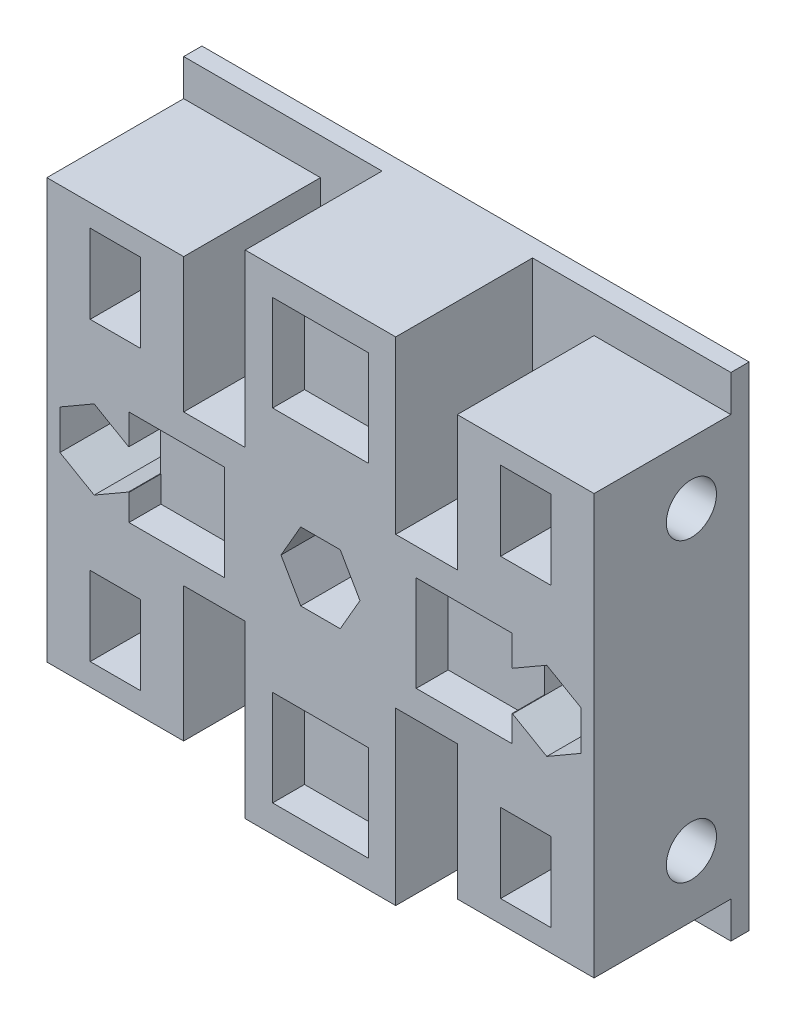
from build123d import *

# Parameters (mm, degrees)
ESQUISSE1_W               = 60
ESQUISSE1_H               = 54
ESQUISSE1_R               = 2
BOSS_EXTRU_1_DEPTH        = 2
ESQUISSE2_W               = 15
ESQUISSE2_H               = 13.5
BOSS_EXTRU_2_DEPTH        = 15
ENL_V_MAT_EXTRU_2_DEPTH   = 16
ESQUISSE5_W               = 4.75
ESQUISSE5_H               = 13.5
BOSS_EXTRU_3_DEPTH        = 17
ESQUISSE6_W               = 5.5
ESQUISSE6_H               = 8.66
ENL_V_MAT_EXTRU_3_DEPTH   = 11.25
ESQUISSE7_R               = 2.75
ENL_V_MAT_EXTRU_4_DEPTH   = 28
SYM_TRIE2_COPY_1_SKETCH_W = 15
SYM_TRIE2_COPY_1_SKETCH_H = 13.5
SYM_TRIE2_COPY_1_DEPTH    = 15
SYM_TRIE2_COPY_2_DEPTH    = 16
SYM_TRIE2_COPY_3_SKETCH_W = 4.75
SYM_TRIE2_COPY_3_SKETCH_H = 13.5
SYM_TRIE2_COPY_3_DEPTH    = 17
SYM_TRIE2_COPY_4_SKETCH_W = 5.5
SYM_TRIE2_COPY_4_SKETCH_H = 8.66
SYM_TRIE2_COPY_4_DEPTH    = 11.25
SYM_TRIE2_COPY_5_SKETCH_R = 2.75
SYM_TRIE2_COPY_5_DEPTH    = 28
ESQUISSE8_W               = 10.5
ESQUISSE8_H               = 3
BOSS_EXTRU_4_DEPTH        = 15
ESQUISSE12_W              = 15
ESQUISSE12_H              = 19
BOSS_EXTRU_6_DEPTH        = 15
ESQUISSE9_W               = 16.5
ESQUISSE9_H               = 16.5
ESQUISSE9_W_2             = 10.5
ESQUISSE9_H_2             = 10.5
BOSS_EXTRU_7_DEPTH        = 15
ENL_V_MAT_EXTRU_6_DEPTH   = 21
ESQUISSE13_W              = 10.5
ESQUISSE13_H              = 10.5
ENL_V_MAT_EXTRU_7_DEPTH   = 21
ESQUISSE15_R              = 2
ESQUISSE15_W              = 0.75
ESQUISSE15_H              = 2.25
BOSS_EXTRU_9_DEPTH        = 15
ENL_V_MAT_EXTRU_8_DEPTH   = 10
ESQUISSE17_W              = 10.5
ESQUISSE17_H              = 10.5
BOSS_EXTRU_10_DEPTH       = 11.5
ESQUISSE18_W              = 3.5
ESQUISSE18_H              = 4.330127019
ENL_V_MAT_EXTRU_9_DEPTH   = 1.5


with BuildPart() as part:
    # Esquisse1 → Boss.-Extru.1 (new body)
    with BuildSketch(Plane.XY):
        with Locations((30, -27)):
            Rectangle(ESQUISSE1_W, ESQUISSE1_H)
        with Locations((5, -27)):
            Circle(ESQUISSE1_R, mode=Mode.SUBTRACT)
        with Locations((30, -27)):
            Circle(ESQUISSE1_R, mode=Mode.SUBTRACT)
        with Locations((55, -27)):
            Circle(ESQUISSE1_R, mode=Mode.SUBTRACT)
    extrude(amount=BOSS_EXTRU_1_DEPTH)

    # Esquisse2 → Boss.-Extru.2 (add)
    with BuildSketch(Plane.XY.offset(2)):
        with Locations((7.5, -43.25)):
            Rectangle(ESQUISSE2_W, ESQUISSE2_H)
    boss_extru_2 = extrude(amount=BOSS_EXTRU_2_DEPTH)

    # Esquisse4 → Enlèv. mat.-Extru.2 (cut)
    with BuildSketch(Plane.ZY):
        Polygon((9.5, -45.415063509), (9.5, -41.084936491), (5.75, -38.919872981), (2, -41.084936491), (2, -45.415063509), (5.75, -47.580127019), align=None)
    enl_v_mat_extru_2 = extrude(amount=-ENL_V_MAT_EXTRU_2_DEPTH, mode=Mode.SUBTRACT)

    # Esquisse5 → Boss.-Extru.3 (add)
    with BuildSketch(Plane.XY.offset(17)):
        with Locations((2.375, -43.25)):
            Rectangle(ESQUISSE5_W, ESQUISSE5_H)
        with Locations((12.625, -43.25)):
            Rectangle(ESQUISSE5_W, ESQUISSE5_H)
    boss_extru_3 = extrude(amount=-BOSS_EXTRU_3_DEPTH)

    # Esquisse6 → Enlèv. mat.-Extru.3 (cut)
    with BuildSketch(Plane.XY.offset(17)):
        with Locations((7.5, -43.25)):
            Rectangle(ESQUISSE6_W, ESQUISSE6_H)
    enl_v_mat_extru_3 = extrude(amount=-ENL_V_MAT_EXTRU_3_DEPTH, mode=Mode.SUBTRACT)

    # Esquisse7 → Enlèv. mat.-Extru.4 (cut)
    with BuildSketch(Plane.ZY):
        with Locations((6.33, -43.25)):
            Circle(ESQUISSE7_R)
    enl_v_mat_extru_4 = extrude(amount=-ENL_V_MAT_EXTRU_4_DEPTH, mode=Mode.SUBTRACT)

    # Symétrie1: Boss.-Extru.2, Enlèv. mat.-Extru.2, Boss.-Extru.3, Enlèv. mat.-Extru.3, Enlèv. mat.-Extru.4 across plane
    add(boss_extru_2.mirror(Plane(origin=(0, -27, 0), x_dir=(0, 0, 1), z_dir=(0, -1, 0))))
    add(enl_v_mat_extru_2.mirror(Plane(origin=(0, -27, 0), x_dir=(0, 0, 1), z_dir=(0, -1, 0))), mode=Mode.SUBTRACT)
    add(boss_extru_3.mirror(Plane(origin=(0, -27, 0), x_dir=(0, 0, 1), z_dir=(0, -1, 0))))
    add(enl_v_mat_extru_3.mirror(Plane(origin=(0, -27, 0), x_dir=(0, 0, 1), z_dir=(0, -1, 0))), mode=Mode.SUBTRACT)
    add(enl_v_mat_extru_4.mirror(Plane(origin=(0, -27, 0), x_dir=(0, 0, 1), z_dir=(0, -1, 0))), mode=Mode.SUBTRACT)

    # Symétrie2: Boss.-Extru.2, Enlèv. mat.-Extru.2, Boss.-Extru.3, Enlèv. mat.-Extru.3, Enlèv. mat.-Extru.4 across plane
    add(boss_extru_2.mirror(Plane.ZY.offset(-30)))
    add(enl_v_mat_extru_2.mirror(Plane.ZY.offset(-30)), mode=Mode.SUBTRACT)
    add(boss_extru_3.mirror(Plane.ZY.offset(-30)))
    add(enl_v_mat_extru_3.mirror(Plane.ZY.offset(-30)), mode=Mode.SUBTRACT)
    add(enl_v_mat_extru_4.mirror(Plane.ZY.offset(-30)), mode=Mode.SUBTRACT)

    # Symétrie2 copy 1 sketch → Symétrie2 copy 1 (add)
    with BuildSketch(Plane(origin=(60, -54, 2), x_dir=(-1, 0, 0), z_dir=(0, 0, 1))):
        with Locations((7.5, -43.25)):
            Rectangle(SYM_TRIE2_COPY_1_SKETCH_W, SYM_TRIE2_COPY_1_SKETCH_H)
    extrude(amount=SYM_TRIE2_COPY_1_DEPTH)

    # Symétrie2 copy 2 sketch → Symétrie2 copy 2 (cut)
    with BuildSketch(Plane(origin=(60, -54, 0), x_dir=(0, 0, 1), z_dir=(1, 0, 0))):
        Polygon((9.5, -45.415063509), (9.5, -41.084936491), (5.75, -38.919872981), (2, -41.084936491), (2, -45.415063509), (5.75, -47.580127019), align=None)
    extrude(amount=-SYM_TRIE2_COPY_2_DEPTH, mode=Mode.SUBTRACT)

    # Symétrie2 copy 3 sketch → Symétrie2 copy 3 (add)
    with BuildSketch(Plane(origin=(60, -54, 17), x_dir=(-1, 0, 0), z_dir=(0, 0, 1))):
        with Locations((2.375, -43.25)):
            Rectangle(SYM_TRIE2_COPY_3_SKETCH_W, SYM_TRIE2_COPY_3_SKETCH_H)
        with Locations((12.625, -43.25)):
            Rectangle(SYM_TRIE2_COPY_3_SKETCH_W, SYM_TRIE2_COPY_3_SKETCH_H)
    extrude(amount=-SYM_TRIE2_COPY_3_DEPTH)

    # Symétrie2 copy 4 sketch → Symétrie2 copy 4 (cut)
    with BuildSketch(Plane(origin=(60, -54, 17), x_dir=(-1, 0, 0), z_dir=(0, 0, 1))):
        with Locations((7.5, -43.25)):
            Rectangle(SYM_TRIE2_COPY_4_SKETCH_W, SYM_TRIE2_COPY_4_SKETCH_H)
    extrude(amount=-SYM_TRIE2_COPY_4_DEPTH, mode=Mode.SUBTRACT)

    # Symétrie2 copy 5 sketch → Symétrie2 copy 5 (cut)
    with BuildSketch(Plane(origin=(60, -54, 0), x_dir=(0, 0, 1), z_dir=(1, 0, 0))):
        with Locations((6.33, -43.25)):
            Circle(SYM_TRIE2_COPY_5_SKETCH_R)
    extrude(amount=-SYM_TRIE2_COPY_5_DEPTH, mode=Mode.SUBTRACT)

    # Esquisse8 → Boss.-Extru.4 (add)
    with BuildSketch(Plane.XY.offset(2)):
        Polygon((35.25, -51), (35.25, -54), (38.25, -54), (38.25, -37.5), (21.75, -37.5), (21.75, -54), (24.75, -54), (24.75, -51), (24.75, -40.5), (35.25, -40.5), align=None)
        with Locations((30, -52.5)):
            Rectangle(ESQUISSE8_W, ESQUISSE8_H)
    boss_extru_4 = extrude(amount=BOSS_EXTRU_4_DEPTH)

    # Esquisse12 → Boss.-Extru.6 (add)
    with BuildSketch(Plane.XY.offset(2)):
        with Locations((7.5, -27)):
            Rectangle(ESQUISSE12_W, ESQUISSE12_H)
    boss_extru_6 = extrude(amount=BOSS_EXTRU_6_DEPTH)

    # Esquisse9 → Boss.-Extru.7 (add)
    with BuildSketch(Plane.XY.offset(2)):
        with Locations((14.25, -27)):
            Rectangle(ESQUISSE9_W, ESQUISSE9_H)
        with Locations((14.25, -27)):
            Rectangle(ESQUISSE9_W_2, ESQUISSE9_H_2, mode=Mode.SUBTRACT)
    boss_extru_7 = extrude(amount=BOSS_EXTRU_7_DEPTH)

    # Esquisse11 → Enlèv. mat.-Extru.6 (cut)
    with BuildSketch(Plane.XY.offset(2)):
        Polygon((8.935840957, -29.386947115), (8.935840957, -25.056820096), (5.185840957, -22.891756586), (1.435840957, -25.056820096), (1.435840957, -29.386947115), (5.185840957, -31.552010624), align=None)
    enl_v_mat_extru_6 = extrude(amount=ENL_V_MAT_EXTRU_6_DEPTH, mode=Mode.SUBTRACT)

    # Esquisse13 → Enlèv. mat.-Extru.7 (cut)
    with BuildSketch(Plane.XY.offset(2)):
        with Locations((14.25, -27)):
            Rectangle(ESQUISSE13_W, ESQUISSE13_H)
    enl_v_mat_extru_7 = extrude(amount=ENL_V_MAT_EXTRU_7_DEPTH, mode=Mode.SUBTRACT)

    # Symétrie3: Boss.-Extru.6, Boss.-Extru.7, Enlèv. mat.-Extru.6, Enlèv. mat.-Extru.7 across plane
    add(boss_extru_6.mirror(Plane.ZY.offset(-30)))
    add(boss_extru_7.mirror(Plane.ZY.offset(-30)))
    add(enl_v_mat_extru_6.mirror(Plane.ZY.offset(-30)), mode=Mode.SUBTRACT)
    add(enl_v_mat_extru_7.mirror(Plane.ZY.offset(-30)), mode=Mode.SUBTRACT)

    # Symétrie4: Boss.-Extru.4 across plane
    add(boss_extru_4.mirror(Plane(origin=(0, -27, 0), x_dir=(0, 0, 1), z_dir=(0, -1, 0))))

    # Esquisse15 → Boss.-Extru.9 (add)
    # profile 1 of 5: a face of its own
    with BuildSketch(Plane.XY.offset(2)):
        Polygon((22.5, -35.25), (22.5, -37.5), (37.5, -37.5), (37.5, -35.25), (37.5, -18.75), (37.5, -16.5), (22.5, -16.5), (22.5, -18.75), align=None)
        with Locations((30, -27)):
            Circle(ESQUISSE15_R, mode=Mode.SUBTRACT)
    # profile 2 of 5: a face of its own
    with BuildSketch(Plane.XY.offset(2)):
        with Locations((22.125, -36.375)):
            Rectangle(ESQUISSE15_W, ESQUISSE15_H)
    # profile 3 of 5: a face of its own
    with BuildSketch(Plane.XY.offset(2)):
        with Locations((37.875, -36.375)):
            Rectangle(ESQUISSE15_W, ESQUISSE15_H)
    # profile 4 of 5: a face of its own
    with BuildSketch(Plane.XY.offset(2)):
        with Locations((37.875, -17.625)):
            Rectangle(ESQUISSE15_W, ESQUISSE15_H)
    # profile 5 of 5: a face of its own
    with BuildSketch(Plane.XY.offset(2)):
        with Locations((22.125, -17.625)):
            Rectangle(ESQUISSE15_W, ESQUISSE15_H)
    extrude(amount=BOSS_EXTRU_9_DEPTH)

    # Esquisse16 → Enlèv. mat.-Extru.8 (cut)
    with BuildSketch(Plane.XY.offset(17)):
        Polygon((32.165063509, -23.25), (27.834936491, -23.25), (25.669872981, -27), (27.834936491, -30.75), (32.165063509, -30.75), (34.330127019, -27), align=None)
    extrude(amount=-ENL_V_MAT_EXTRU_8_DEPTH, mode=Mode.SUBTRACT)

    # Esquisse17 → Boss.-Extru.10 (add)
    with BuildSketch(Plane.XY.offset(2)):
        with Locations((14.25, -27)):
            Rectangle(ESQUISSE17_W, ESQUISSE17_H)
        with Locations((45.75, -27)):
            Rectangle(ESQUISSE17_W, ESQUISSE17_H)
        with Locations((30, -8.25)):
            Rectangle(ESQUISSE17_W, ESQUISSE17_H)
        with Locations((30, -45.75)):
            Rectangle(ESQUISSE17_W, ESQUISSE17_H)
    extrude(amount=BOSS_EXTRU_10_DEPTH)

    # Esquisse18 → Enlèv. mat.-Extru.9 (cut)
    with BuildSketch(Plane(origin=(9, 0, 0), x_dir=(0, 0, -1), z_dir=(1, 0, 0))):
        with Locations((-15.25, -27.221883606)):
            Rectangle(ESQUISSE18_W, ESQUISSE18_H)
    enl_v_mat_extru_9 = extrude(amount=-ENL_V_MAT_EXTRU_9_DEPTH, mode=Mode.SUBTRACT)

    # Symétrie5: Enlèv. mat.-Extru.9 across plane
    add(enl_v_mat_extru_9.mirror(Plane.ZY.offset(-30)), mode=Mode.SUBTRACT)


solid = part.part
